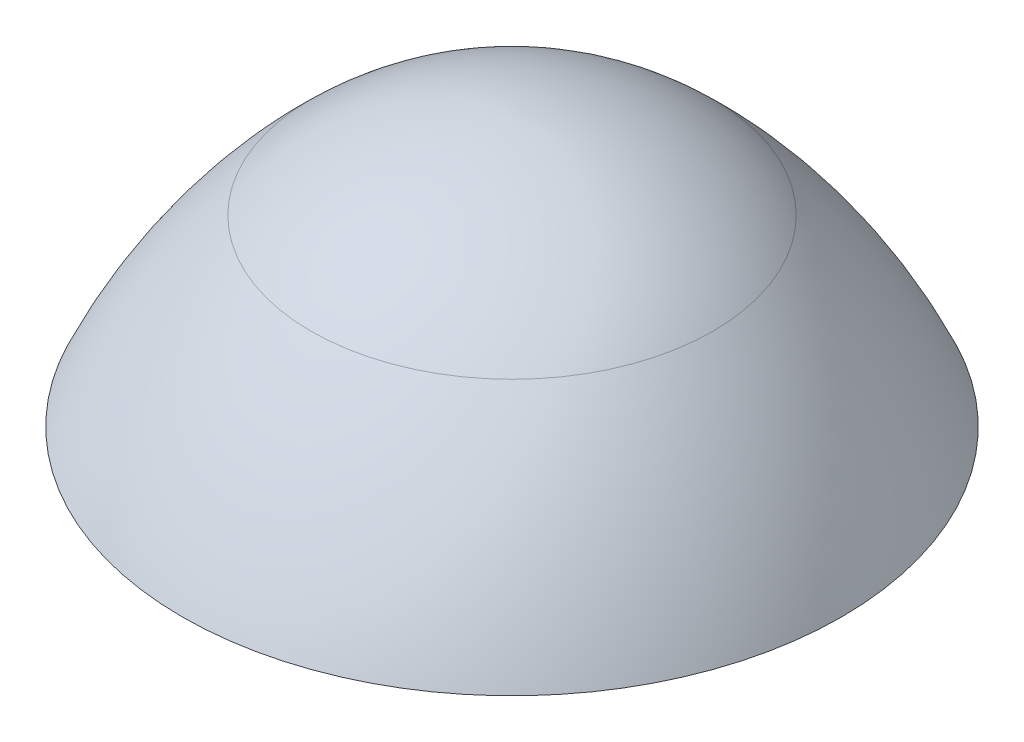
from build123d import *

# Parameters (mm, degrees)
SHELL1_T = -2


with BuildPart() as part:
    # Sketch4 → Revolve1 (revolve)
    with BuildSketch(Plane(origin=(0, 0, 0), x_dir=(0, 0, -1), z_dir=(1, 0, 0)), mode=Mode.PRIVATE) as revolve1_sk:
        with BuildLine():
            Line((0, 0), (-4.93, 0))
            ThreePointArc((-4.93, 0), (-4.099613253, 1.461524128), (-3.005121647, 2.737330951))
            ThreePointArc((-3.005121647, 2.737330951), (-1.61998505, 3.648132281), (0, 4))
            Line((0, 4), (0, 0))
        make_face()
    revolve(revolve1_sk.sketch.rotate(Axis((0, 0, 0), (0, 1, 0)), 180), axis=Axis((0, 0, 0), (0, 1, 0)))

    # Shell1
    shell1_openings = [part.faces().sort_by_distance(p)[0] for p in [
        (0, 0, 0),
    ]]
    offset(amount=SHELL1_T, openings=shell1_openings, kind=Kind.INTERSECTION)


solid = part.part
